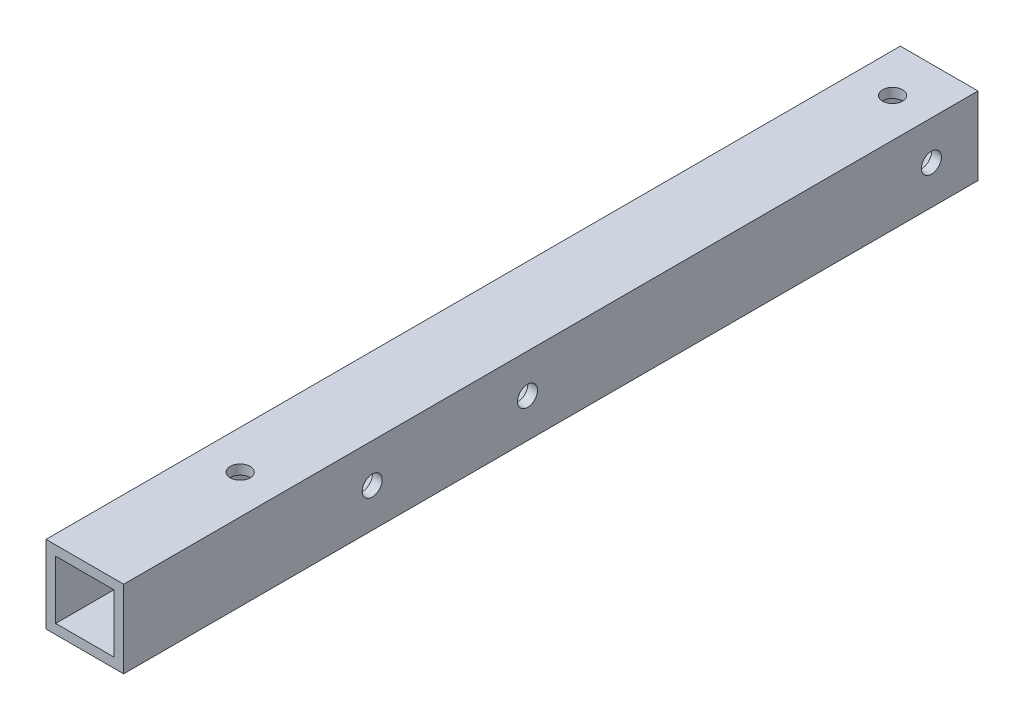
from build123d import *

# Parameters (mm, degrees)
SKETCH2_W           = 25.4
SKETCH2_H           = 25.4
BOSS_EXTRUDE1_DEPTH = 279.4
SKETCH4_W           = 19.05
SKETCH4_H           = 19.05
CUT_EXTRUDE1_DEPTH  = 280.9766776
SKETCH5_R           = 3.2639
CUT_EXTRUDE2_DEPTH  = 281.839473721
SKETCH6_R           = 3.2639
CUT_EXTRUDE3_DEPTH  = 281.839473721
SKETCH7_R           = 3.2639
CUT_EXTRUDE4_DEPTH  = 281.839473721
SKETCH8_R           = 3.2639
CUT_EXTRUDE5_DEPTH  = 281.839473721


with BuildPart() as part:
    # Sketch2 → Boss-Extrude1 (new body)
    with BuildSketch(Plane.XY):
        Rectangle(SKETCH2_W, SKETCH2_H)
    extrude(amount=BOSS_EXTRUDE1_DEPTH)

    # Sketch4 → Cut-Extrude1 (cut, through all)
    with BuildSketch(Plane.XY):
        Rectangle(SKETCH4_W, SKETCH4_H)
    extrude(amount=CUT_EXTRUDE1_DEPTH, mode=Mode.SUBTRACT)

    # Sketch5 → Cut-Extrude2 (cut, through all)
    with BuildSketch(Plane(origin=(0, 12.7, 0), x_dir=(1, 0, 0), z_dir=(0, 1, 0))):
        with Locations(Location((0, -15.24, 0), (0, 0, 270))):
            Circle(SKETCH5_R)
    extrude(amount=-CUT_EXTRUDE2_DEPTH, mode=Mode.SUBTRACT)

    # Sketch6 → Cut-Extrude3 (cut, through all)
    with BuildSketch(Plane(origin=(0, 12.7, 0), x_dir=(1, 0, 0), z_dir=(0, 1, 0))):
        with Locations(Location((0, -228.6, 0), (0, 0, 270))):
            Circle(SKETCH6_R)
    extrude(amount=-CUT_EXTRUDE3_DEPTH, mode=Mode.SUBTRACT)

    # Sketch7 → Cut-Extrude4 (cut, through all)
    with BuildSketch(Plane.ZY.offset(12.7)):
        with Locations((15.24, 0)):
            Circle(SKETCH7_R)
    extrude(amount=-CUT_EXTRUDE4_DEPTH, mode=Mode.SUBTRACT)

    # Sketch8 → Cut-Extrude5 (cut, through all)
    with BuildSketch(Plane.ZY.offset(12.7)):
        with Locations((198.12, 0)):
            Circle(SKETCH8_R)
        with Locations((147.32, 0)):
            Circle(SKETCH8_R)
    extrude(amount=-CUT_EXTRUDE5_DEPTH, mode=Mode.SUBTRACT)


solid = part.part
